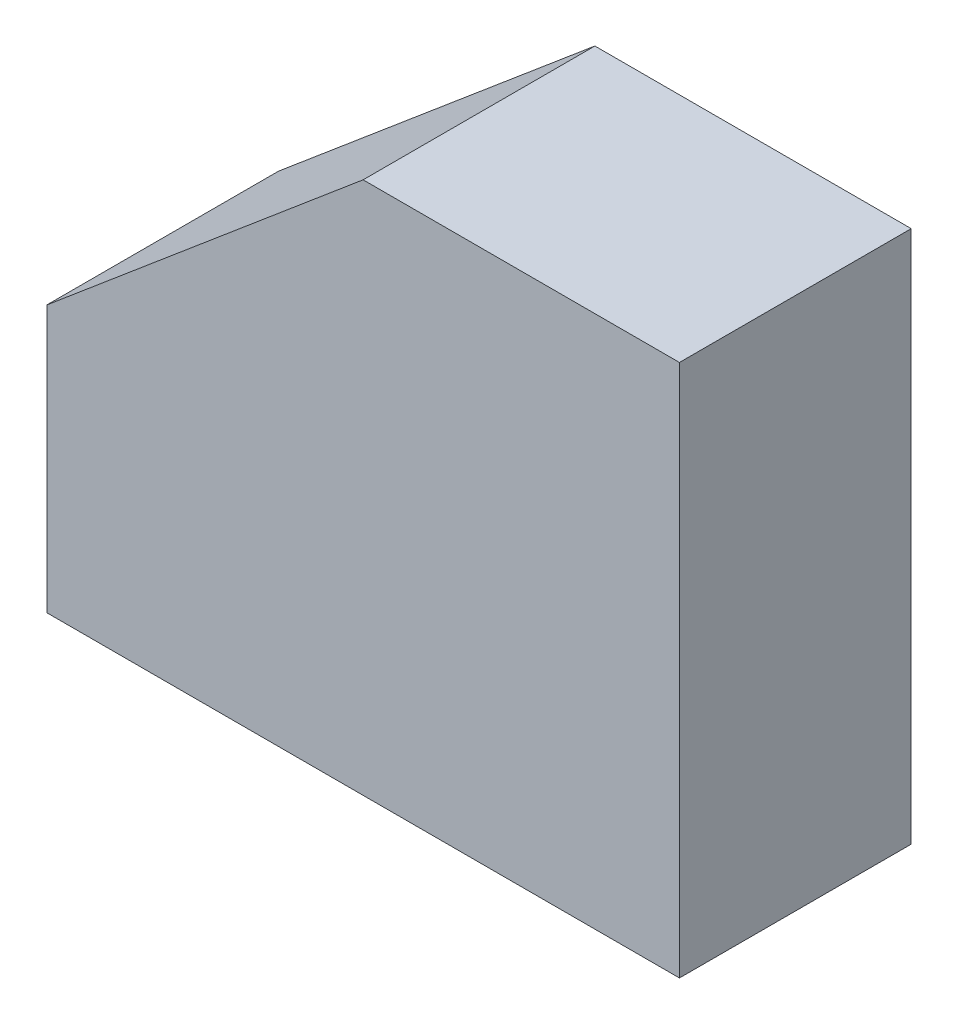
from build123d import *

# Parameters (mm, degrees)
SKETCH1_W          = 13.648457072
SKETCH1_H          = 11.499915192
EXTRUDE1_DEPTH     = 2.5
CUT_EXTRUDE1_DEPTH = 10


with BuildPart() as part:
    # Sketch1 → Extrude1 (new, symmetric)
    with BuildSketch(Plane.XY):
        with Locations((6.824228536, 5.749957596)):
            Rectangle(SKETCH1_W, SKETCH1_H)
    extrude(amount=EXTRUDE1_DEPTH, both=True)

    # Sketch2 → Cut-Extrude1 (cut)
    with BuildSketch(Plane(origin=(0, 0, -2.5), x_dir=(-1, 0, 0), z_dir=(0, 0, -1))):
        Polygon((-6.824228536, 11.499915192), (0, 5.749957596), (0, 11.499915192), align=None)
    extrude(amount=-CUT_EXTRUDE1_DEPTH, mode=Mode.SUBTRACT)


solid = part.part
